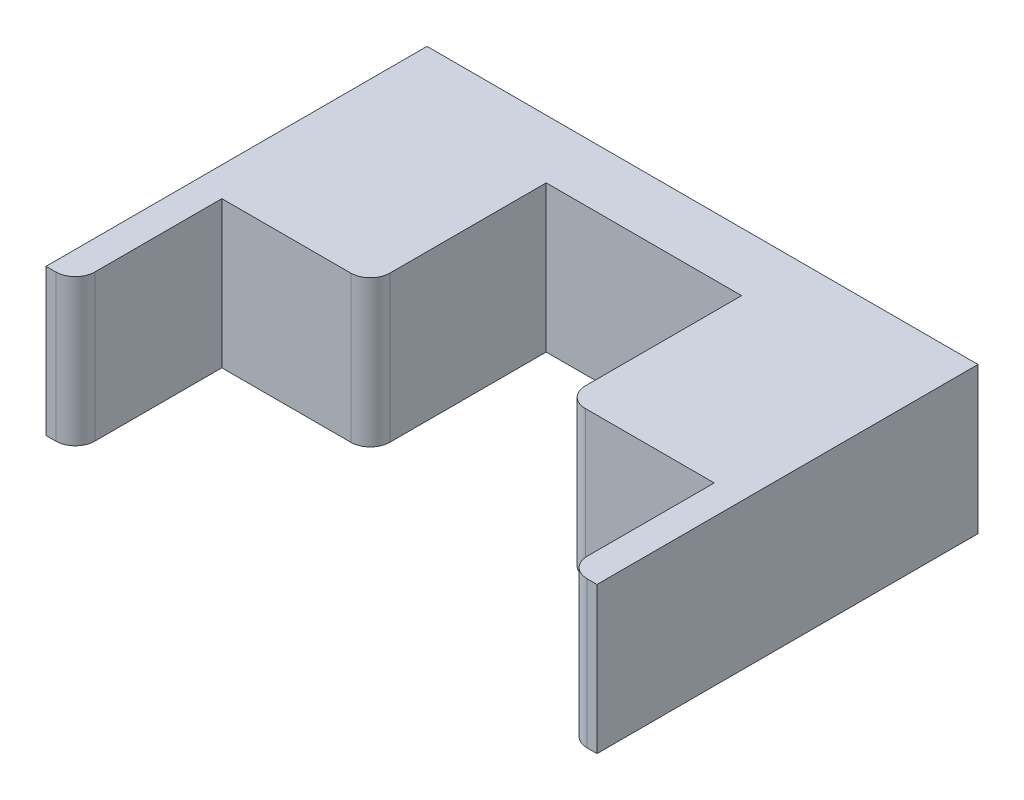
from build123d import *

# Parameters (mm, degrees)
BOSS_EXTRUDE1_DEPTH = 15
FILLET2_R           = 2


with BuildPart() as part:
    # Sketch1 → Boss-Extrude1 (new body)
    with BuildSketch(Plane(origin=(0, 0, 0), x_dir=(1, 0, 0), z_dir=(0, 1, 0))):
        Polygon((26.949275536, 0.12972973), (29.949275536, 0.12972973), (29.949275536, 39.12972973), (-26.450724464, 39.12972973), (-26.450724464, 0.12972973), (-23.450724464, 0.12972973), (-23.450724464, 15.12972973), (-8.250724464, 15.12972973), (-8.250724464, 33.12972973), (11.749275536, 33.12972973), (11.749275536, 15.12972973), (26.949275536, 15.12972973), align=None)
    extrude(amount=BOSS_EXTRUDE1_DEPTH)

    # Fillet2
    fillet2_edges = [part.edges().sort_by_distance(p)[0] for p in [
        (26.949275536, 7.5, -0.12972973),
        (11.749275536, 7.5, -15.12972973),
        (-8.250724464, 7.5, -15.12972973),
        (-23.450724464, 7.5, -0.12972973),
    ]]
    fillet(fillet2_edges, radius=FILLET2_R)


solid = part.part
